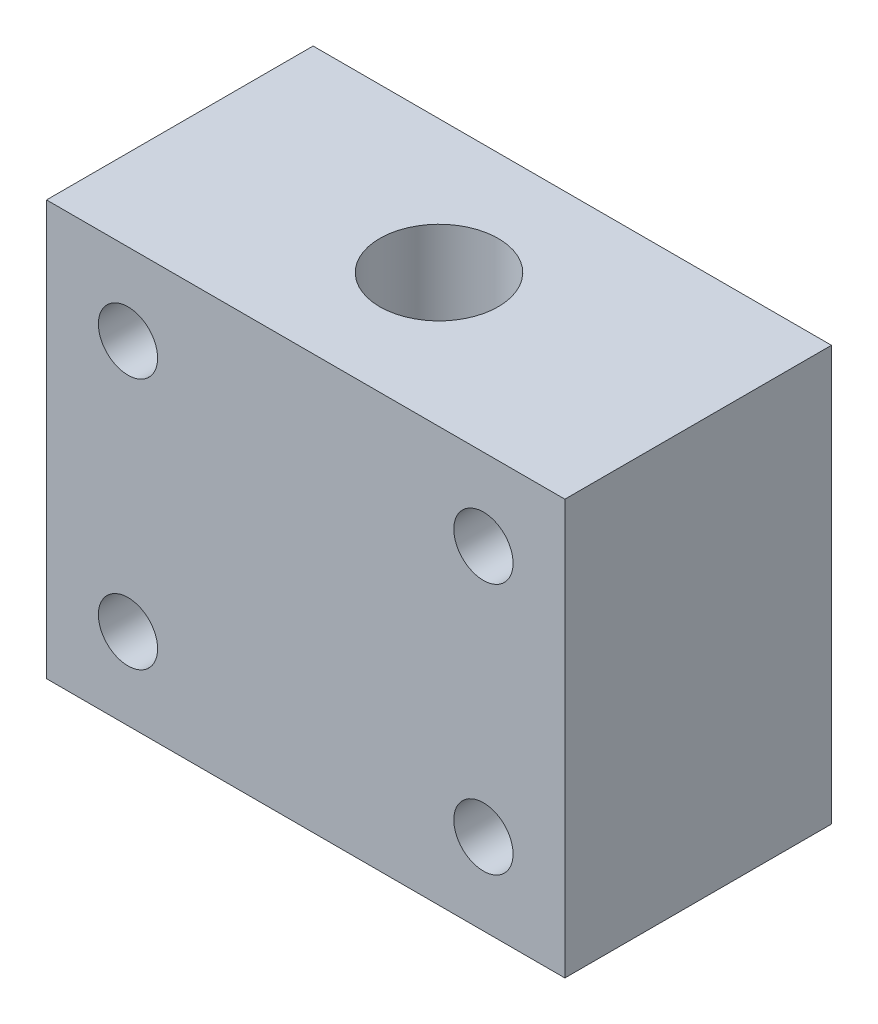
from build123d import *

# Parameters (mm, degrees)
SKETCH1_W           = 35
SKETCH1_H           = 28
SKETCH1_R           = 2
BOSS_EXTRUDE1_DEPTH = 18
SKETCH2_R           = 4
CUT_EXTRUDE1_DEPTH  = 43.721340305


with BuildPart() as part:
    # Sketch1 → Boss-Extrude1 (new body)
    with BuildSketch(Plane.XY):
        with Locations((-13.540903953, 5.778964085)):
            Rectangle(SKETCH1_W, SKETCH1_H)
        with Locations((-25.540903953, 14.278964085)):
            Circle(SKETCH1_R, mode=Mode.SUBTRACT)
        with Locations((-1.540903953, 14.278964085)):
            Circle(SKETCH1_R, mode=Mode.SUBTRACT)
        with Locations((-25.540903953, -2.721035915)):
            Circle(SKETCH1_R, mode=Mode.SUBTRACT)
        with Locations((-1.540903953, -2.721035915)):
            Circle(SKETCH1_R, mode=Mode.SUBTRACT)
    extrude(amount=BOSS_EXTRUDE1_DEPTH)

    # Sketch2 → Cut-Extrude1 (cut, through all)
    with BuildSketch(Plane(origin=(-4.261939868, -8.221035915, 0), x_dir=(0, 0, -1), z_dir=(0, 1, 0))):
        with Locations(Location((-9, 9.278964085, 0), (0, 0, 180))):
            Circle(SKETCH2_R)
    extrude(amount=CUT_EXTRUDE1_DEPTH, mode=Mode.SUBTRACT)


solid = part.part
